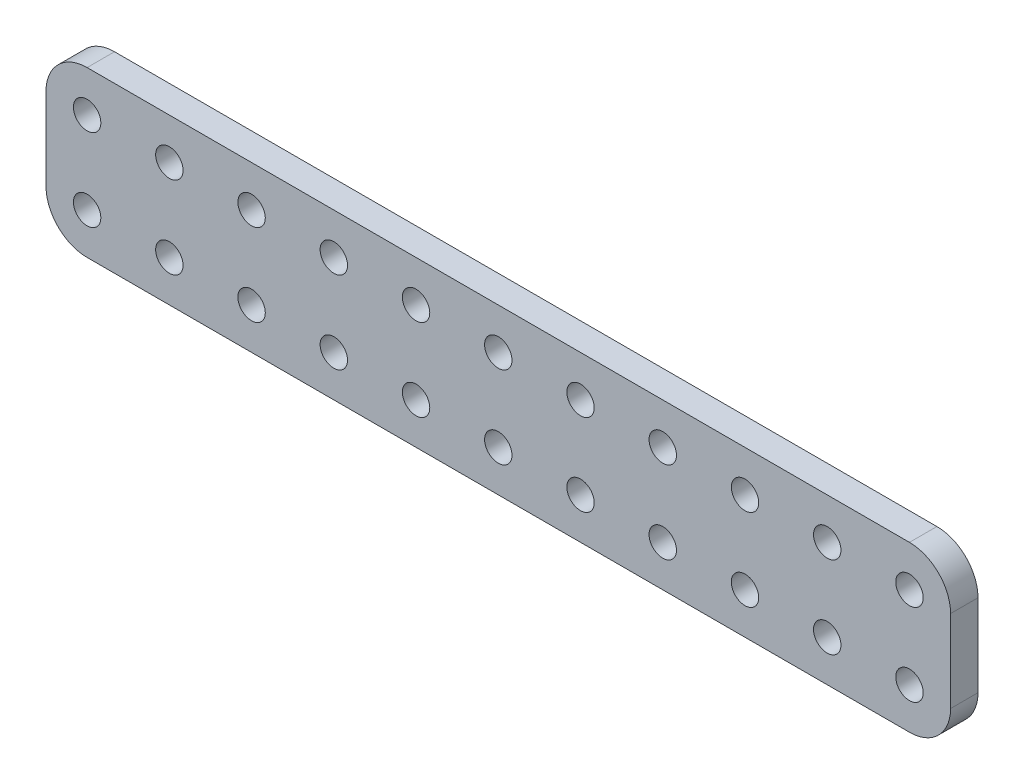
from build123d import *

# Parameters (mm, degrees)
MODEL_R                 = 1.5
SALIENTE_EXTRUIR1_DEPTH = 3


with BuildPart() as part:
    # Model → Saliente-Extruir1 (new body)
    with BuildSketch(Plane.XY):
        with BuildLine():
            Line((256.429131311, 228.742243614), (346.429131311, 228.742243614))
            ThreePointArc((346.429131311, 228.742243614), (349.611111826, 227.424224129), (350.929131311, 224.242243614))
            Line((350.929131311, 224.242243614), (350.929131311, 215.242243614))
            ThreePointArc((350.929131311, 215.242243614), (349.611111826, 212.060263099), (346.429131311, 210.742243614))
            Line((346.429131311, 210.742243614), (256.429131311, 210.742243614))
            ThreePointArc((256.429131311, 210.742243614), (253.247150795, 212.060263099), (251.929131311, 215.242243614))
            Line((251.929131311, 215.242243614), (251.929131311, 224.242243614))
            ThreePointArc((251.929131311, 224.242243614), (253.247150795, 227.424224129), (256.429131311, 228.742243614))
        make_face()
        with Locations((310.429131311, 224.242243614)):
            Circle(MODEL_R, mode=Mode.SUBTRACT)
        with Locations((292.429131311, 224.242243614)):
            Circle(MODEL_R, mode=Mode.SUBTRACT)
        with Locations((301.429131311, 224.242243614)):
            Circle(MODEL_R, mode=Mode.SUBTRACT)
        with Locations((337.429131311, 215.242243614)):
            Circle(MODEL_R, mode=Mode.SUBTRACT)
        with Locations((319.429131311, 215.242243614)):
            Circle(MODEL_R, mode=Mode.SUBTRACT)
        with Locations((328.429131311, 215.242243614)):
            Circle(MODEL_R, mode=Mode.SUBTRACT)
        with Locations((310.429131311, 215.242243614)):
            Circle(MODEL_R, mode=Mode.SUBTRACT)
        with Locations((292.429131311, 215.242243614)):
            Circle(MODEL_R, mode=Mode.SUBTRACT)
        with Locations((301.429131311, 215.242243614)):
            Circle(MODEL_R, mode=Mode.SUBTRACT)
        with Locations((274.429131311, 215.242243614)):
            Circle(MODEL_R, mode=Mode.SUBTRACT)
        with Locations((283.429131311, 215.242243614)):
            Circle(MODEL_R, mode=Mode.SUBTRACT)
        with Locations((265.429131311, 215.242243614)):
            Circle(MODEL_R, mode=Mode.SUBTRACT)
        with Locations((256.429131311, 215.242243614)):
            Circle(MODEL_R, mode=Mode.SUBTRACT)
        with Locations((346.429131311, 215.242243614)):
            Circle(MODEL_R, mode=Mode.SUBTRACT)
        with Locations((274.429131311, 224.242243614)):
            Circle(MODEL_R, mode=Mode.SUBTRACT)
        with Locations((265.429131311, 224.242243614)):
            Circle(MODEL_R, mode=Mode.SUBTRACT)
        with Locations((256.429131311, 224.242243614)):
            Circle(MODEL_R, mode=Mode.SUBTRACT)
        with Locations((283.429131311, 224.242243614)):
            Circle(MODEL_R, mode=Mode.SUBTRACT)
        with Locations((337.429131311, 224.242243614)):
            Circle(MODEL_R, mode=Mode.SUBTRACT)
        with Locations((319.429131311, 224.242243614)):
            Circle(MODEL_R, mode=Mode.SUBTRACT)
        with Locations((328.429131311, 224.242243614)):
            Circle(MODEL_R, mode=Mode.SUBTRACT)
        with Locations((346.429131311, 224.242243614)):
            Circle(MODEL_R, mode=Mode.SUBTRACT)
    extrude(amount=SALIENTE_EXTRUIR1_DEPTH)


solid = part.part
